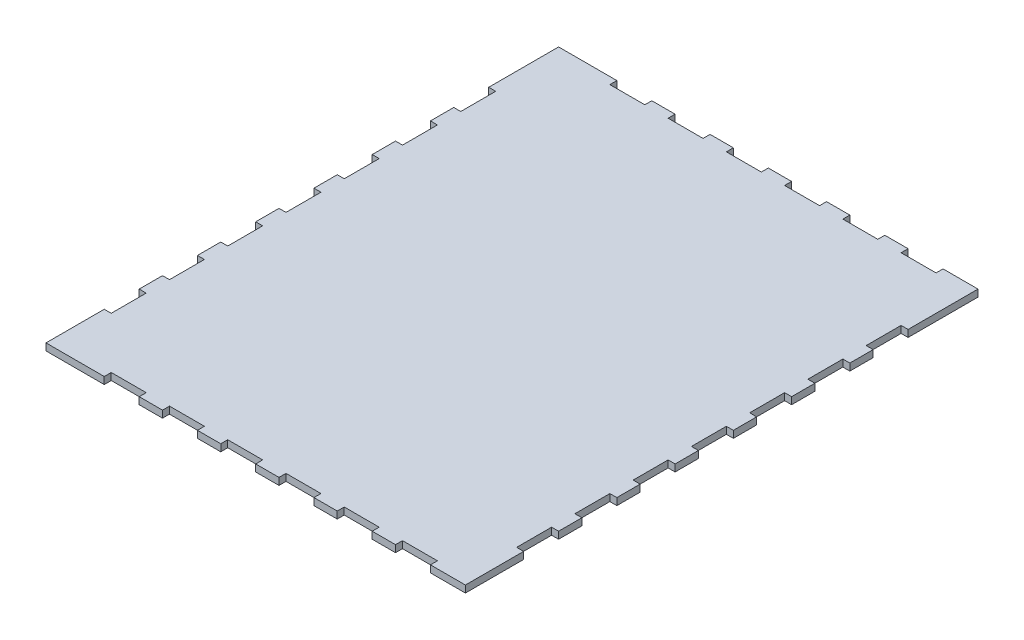
from build123d import *

# Parameters (mm, degrees)
BOSS_EXTRUDE1_DEPTH = 3


with BuildPart() as part:
    # Sketch1 → Boss-Extrude1 (new body)
    with BuildSketch(Plane(origin=(0, 0, 0), x_dir=(1, 0, 0), z_dir=(0, 1, 0))):
        Polygon((-87.356947197, -190.101323735), (-90.356947197, -190.101323735), (-90.356947197, -215.101323735), (-65.356947197, -215.101323735), (-65.356947197, -212.101323735), (-50.356947197, -212.101323735), (-50.356947197, -215.101323735), (-40.356947197, -215.101323735), (-40.356947197, -212.101323735), (-25.356947197, -212.101323735), (-25.356947197, -215.101323735), (-15.356947197, -215.101323735), (-15.356947197, -212.101323735), (-0.356947197, -212.101323735), (-0.356947197, -215.101323735), (9.643052803, -215.101323735), (9.643052803, -212.101323735), (24.643052803, -212.101323735), (24.643052803, -215.101323735), (34.643052803, -215.101323735), (34.643052803, -212.101323735), (49.643052803, -212.101323735), (49.643052803, -215.101323735), (59.643052803, -215.101323735), (59.643052803, -212.101323735), (74.643052803, -212.101323735), (74.643052803, -215.101323735), (89.643052803, -215.101323735), (89.643052803, -190.101323735), (86.643052803, -190.101323735), (86.643052803, -175.101323735), (89.643052803, -175.101323735), (89.643052803, -165.101323735), (86.643052803, -165.101323735), (86.643052803, -150.101323735), (89.643052803, -150.101323735), (89.643052803, -140.101323735), (86.643052803, -140.101323735), (86.643052803, -125.101323735), (89.643052803, -125.101323735), (89.643052803, -115.101323735), (86.643052803, -115.101323735), (86.643052803, -100.101323735), (89.643052803, -100.101323735), (89.643052803, -90.101323735), (86.643052803, -90.101323735), (86.643052803, -75.101323735), (89.643052803, -75.101323735), (89.643052803, -65.101323735), (86.643052803, -65.101323735), (86.643052803, -50.101323735), (89.643052803, -50.101323735), (89.643052803, -40.101323735), (86.643052803, -40.101323735), (86.643052803, -25.101323735), (89.643052803, -25.101323735), (89.643052803, 4.898676265), (74.643052803, 4.898676265), (74.643052803, 1.898676265), (59.643052803, 1.898676265), (59.643052803, 4.898676265), (49.643052803, 4.898676265), (49.643052803, 1.898676265), (34.643052803, 1.898676265), (34.643052803, 4.898676265), (24.643052803, 4.898676265), (24.643052803, 1.898676265), (9.643052803, 1.898676265), (9.643052803, 4.898676265), (-0.356947197, 4.898676265), (-0.356947197, 1.898676265), (-15.356947197, 1.898676265), (-15.356947197, 4.898676265), (-25.356947197, 4.898676265), (-25.356947197, 1.898676265), (-40.356947197, 1.898676265), (-40.356947197, 4.898676265), (-50.356947197, 4.898676265), (-50.356947197, 1.898676265), (-65.356947197, 1.898676265), (-65.356947197, 4.898676265), (-90.356947197, 4.898676265), (-90.356947197, -25.101323735), (-87.356947197, -25.101323735), (-87.356947197, -40.101323735), (-90.356947197, -40.101323735), (-90.356947197, -50.101323735), (-87.356947197, -50.101323735), (-87.356947197, -65.101323735), (-90.356947197, -65.101323735), (-90.356947197, -75.101323735), (-87.356947197, -75.101323735), (-87.356947197, -90.101323735), (-90.356947197, -90.101323735), (-90.356947197, -100.101323735), (-87.356947197, -100.101323735), (-87.356947197, -115.101323735), (-90.356947197, -115.101323735), (-90.356947197, -125.101323735), (-87.356947197, -125.101323735), (-87.356947197, -140.101323735), (-90.356947197, -140.101323735), (-90.356947197, -150.101323735), (-87.356947197, -150.101323735), (-87.356947197, -165.101323735), (-90.356947197, -165.101323735), (-90.356947197, -175.101323735), (-87.356947197, -175.101323735), align=None)
    extrude(amount=BOSS_EXTRUDE1_DEPTH)


solid = part.part
